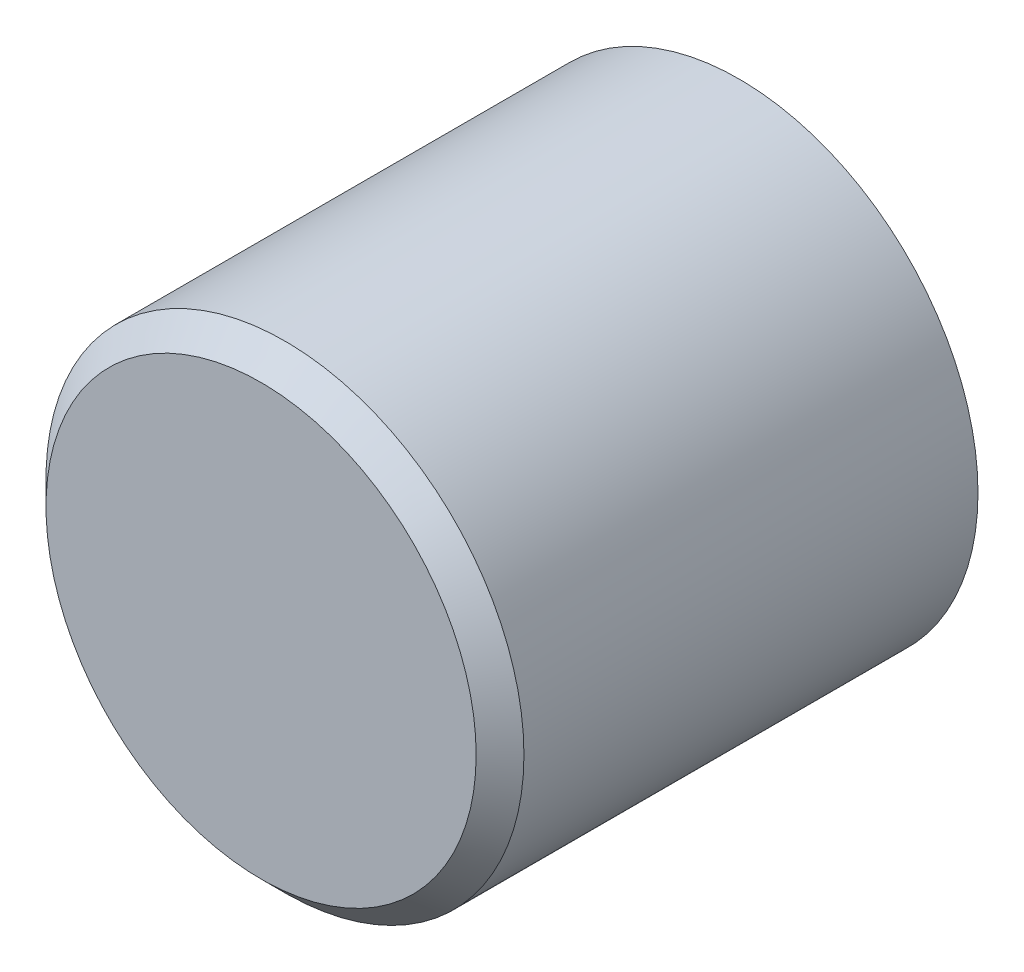
from build123d import *

# Parameters (mm, degrees)
COMPONENT_OUTLINE_R = 1
EXTRUDE1_DEPTH      = 2
CHAMFER1_SIZE       = 0.1


with BuildPart() as part:
    # COMPONENT_OUTLINE → Extrude1 (new body)
    with BuildSketch(Plane.XY):
        Circle(COMPONENT_OUTLINE_R)
    extrude(amount=EXTRUDE1_DEPTH)

    # Chamfer1
    chamfer1_edges = [part.edges().sort_by_distance(p)[0] for p in [
        (-1, 0, 2),
    ]]
    chamfer(chamfer1_edges, length=CHAMFER1_SIZE)


solid = part.part
